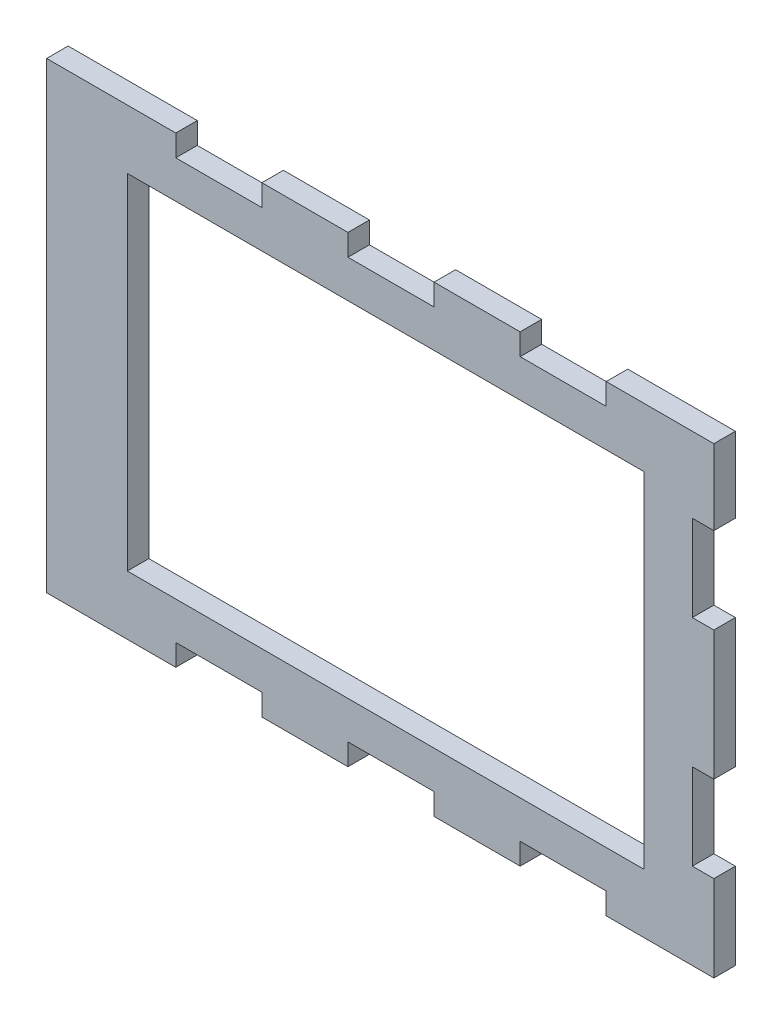
from build123d import *

# Parameters (mm, degrees)
SKETCH1_W           = 196.85
SKETCH1_H           = 136.525
BOSS_EXTRUDE1_DEPTH = 6.35
SKETCH2_W           = 152.4
SKETCH2_H           = 101.6
CUT_EXTRUDE1_DEPTH  = 196.541125609
SKETCH3_W           = 6.35
SKETCH3_H           = 25.4
SKETCH3_H_2         = 25.381347512
SKETCH3_W_2         = 25.4
SKETCH3_H_3         = 6.35
CUT_EXTRUDE2_DEPTH  = 6.35


with BuildPart() as part:
    # Sketch1 → Boss-Extrude1 (new body)
    with BuildSketch(Plane.XY):
        with Locations((-33.205526088, -76.2)):
            Rectangle(SKETCH1_W, SKETCH1_H)
    extrude(amount=BOSS_EXTRUDE1_DEPTH)

    # Sketch2 → Cut-Extrude1 (cut, through all)
    with BuildSketch(Plane.XY.offset(6.35)):
        with Locations((-31.618026088, -76.2)):
            Rectangle(SKETCH2_W, SKETCH2_H)
    extrude(amount=-CUT_EXTRUDE1_DEPTH, mode=Mode.SUBTRACT)

    # Sketch3 → Cut-Extrude2 (cut)
    with BuildSketch(Plane(origin=(0, 0, 0), x_dir=(-1, 0, 0), z_dir=(0, 0, -1))):
        with Locations((-62.044473912, -106.3625)):
            Rectangle(SKETCH3_W, SKETCH3_H)
        with Locations((-62.044473912, -42.853173756)):
            Rectangle(SKETCH3_W, SKETCH3_H_2)
        with Locations((-20.769473912, -11.1125)):
            Rectangle(SKETCH3_W_2, SKETCH3_H_3)
        with Locations((30.030526088, -11.1125)):
            Rectangle(SKETCH3_W_2, SKETCH3_H_3)
        with Locations((80.830526088, -11.1125)):
            Rectangle(SKETCH3_W_2, SKETCH3_H_3)
        with Locations((-20.769473912, -141.2875)):
            Rectangle(SKETCH3_W_2, SKETCH3_H_3)
        with Locations((30.030526088, -141.2875)):
            Rectangle(SKETCH3_W_2, SKETCH3_H_3)
        with Locations((80.830526088, -141.2875)):
            Rectangle(SKETCH3_W_2, SKETCH3_H_3)
    extrude(amount=-CUT_EXTRUDE2_DEPTH, mode=Mode.SUBTRACT)


solid = part.part
